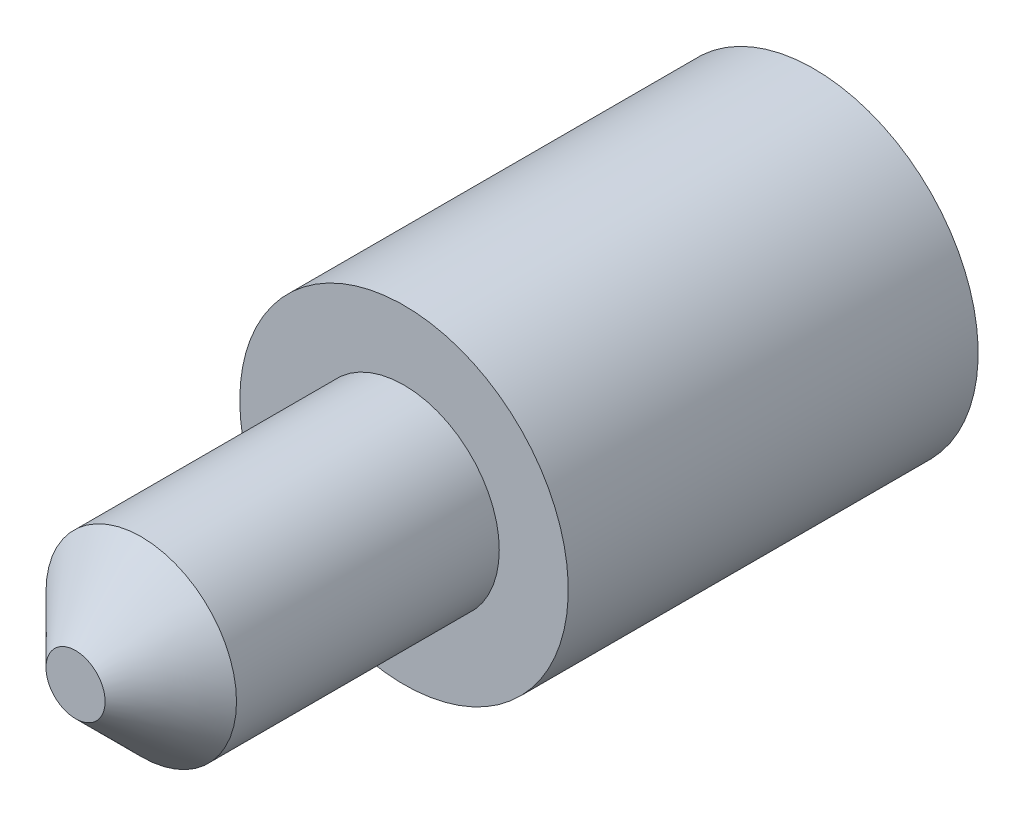
from build123d import *

# Parameters (mm, degrees)
SKETCH_1_R      = 2.5
EXTRUDE_1_DEPTH = 6.24
SKETCH_2_R      = 1.45
EXTRUDE_2_DEPTH = 5
M3X0_51_D       = 2.5
M3X0_51_DEPTH   = 5
M3X0_51_TIP     = 0.751075774
CHAMFER_1_SIZE  = 1


with BuildPart() as part:
    # Эскиз1 → Бобышка-Вытянуть1 (new body)
    with BuildSketch(Plane.XY):
        with Locations(Location((0, 0, 0), (0, 0, 180))):
            Circle(SKETCH_1_R)
    extrude(amount=EXTRUDE_1_DEPTH)

    # Эскиз2 → Бобышка-Вытянуть2 (add)
    with BuildSketch(Plane.XY.offset(6.24)):
        Circle(SKETCH_2_R)
    extrude(amount=EXTRUDE_2_DEPTH)

    # Отверстие обработанное метчиком M3x0.51
    with Locations(Plane(origin=(0, 0, 0), x_dir=(-1, 0, 0), z_dir=(0, 0, -1))):
        with Locations((0, 0)):
            Hole(M3X0_51_D / 2, depth=M3X0_51_DEPTH)
            with Locations((0, 0, -(M3X0_51_DEPTH + M3X0_51_TIP / 2))):  # 118° drill point
                Cone(0, M3X0_51_D / 2, M3X0_51_TIP, mode=Mode.SUBTRACT)

    # Фаска1
    chamfer_1_edges = [part.edges().sort_by_distance(p)[0] for p in [
        (-1.45, 0, 11.24),
    ]]
    chamfer(chamfer_1_edges, length=CHAMFER_1_SIZE)


solid = part.part
